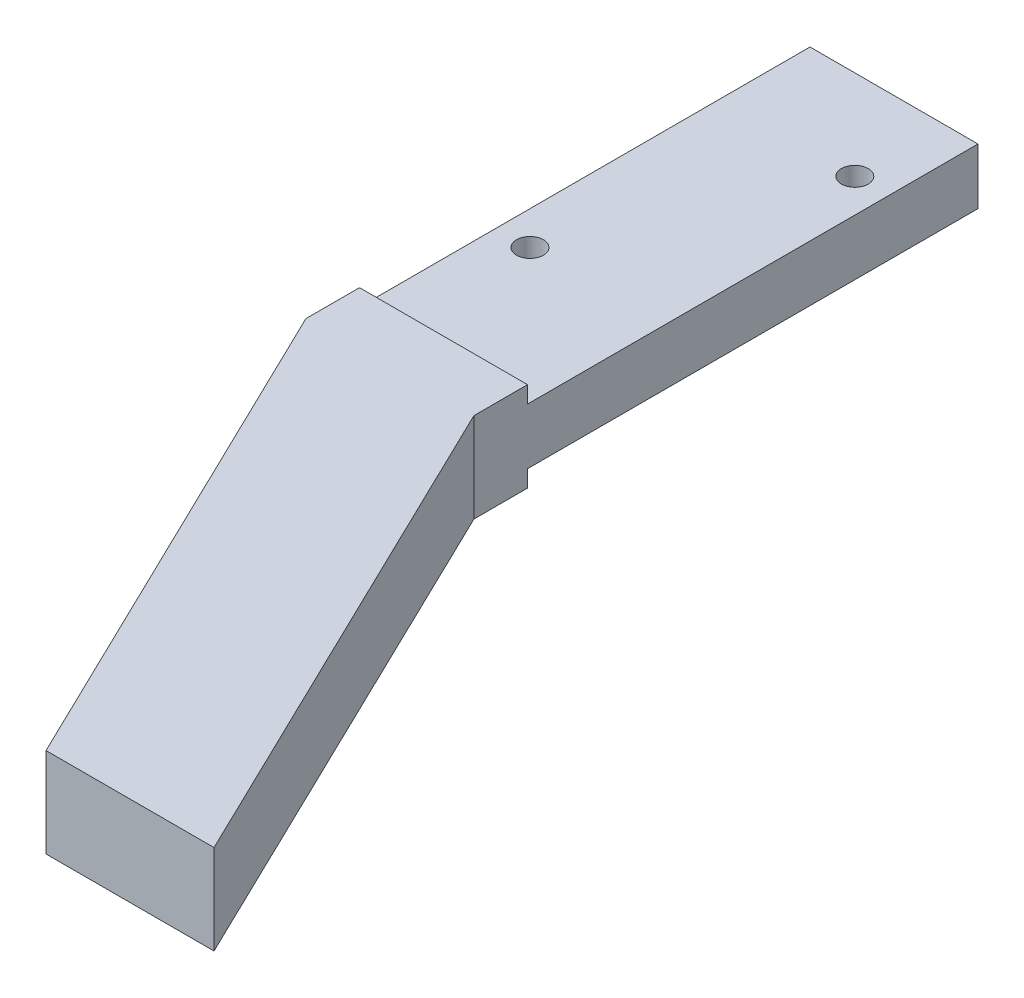
from build123d import *

# Parameters (mm, degrees)
SKETCH1_W           = 15
SKETCH1_H           = 45
SKETCH1_R           = 1.2
BOSS_EXTRUDE1_DEPTH = 2.5
BOSS_EXTRUDE2_DEPTH = 4


with BuildPart() as part:
    # Sketch1 → Boss-Extrude1 (new, symmetric)
    with BuildSketch(Plane(origin=(0, 0, 0), x_dir=(1, 0, 0), z_dir=(0, 1, 0))):
        Rectangle(SKETCH1_W, SKETCH1_H)
        with Locations(Location((-4.5, -5.5, 0), (0, 0, 270))):
            Circle(SKETCH1_R, mode=Mode.SUBTRACT)
        with Locations(Location((4.5, 14.5, 0), (0, 0, 270))):
            Circle(SKETCH1_R, mode=Mode.SUBTRACT)
    extrude(amount=BOSS_EXTRUDE1_DEPTH, both=True)

    # Sketch4 → Boss-Extrude2 (add, symmetric)
    with BuildSketch(Plane(origin=(0, 0, 0), x_dir=(1, 0, 0), z_dir=(0, 1, 0))):
        Polygon((-7.5, -17.715662228), (-7.5, -22.5), (14.294494718, -67.5), (29.294494718, -67.5), (7.5, -22.5), (7.5, -17.715662228), align=None)
    extrude(amount=BOSS_EXTRUDE2_DEPTH, both=True)


solid = part.part
